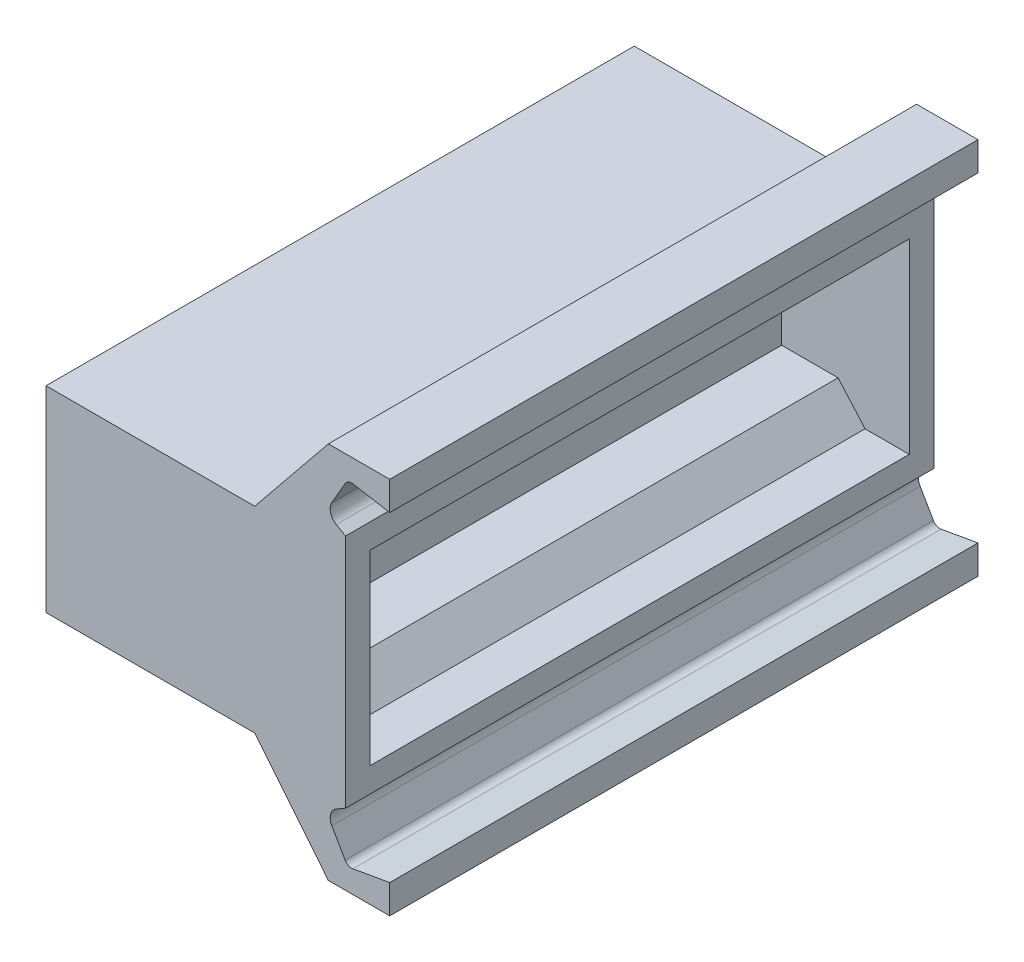
from build123d import *

# Parameters (mm, degrees)
BOSS_EXTRU_1_DEPTH      = 11.98
BOSS_EXTRU_1_DEPTH_BACK = 11.98
BOSS_EXTRU_2_DEPTH      = 1
ESQUISSE3_R             = 1.4
ENL_V_MAT_EXTRU_1_DEPTH = 16.868545408


with BuildPart() as part:
    # Esquisse1 → Boss.-Extru.1 (new, two sides: drawn at the far end of the back side and taken through both)
    with BuildSketch(Plane.XY.offset(-BOSS_EXTRU_1_DEPTH_BACK)):
        with BuildLine():
            Line((0, 4), (0, 2.5))
            Line((0, 2.5), (4.8, 2.5))
            Line((4.8, 2.5), (4.8, -2.5))
            Line((4.8, -2.5), (0, -2.5))
            Line((0, -2.5), (0, -4))
            Line((0, -4), (8.500076, -4))
            Line((8.500076, -4), (11.500006965, -7.699978353))
            Line((11.500006965, -7.699978353), (14, -7.699978353))
            Line((14, -7.699978353), (14, -6.524983133))
            Line((14, -6.524983133), (12.498521064, -6.789609096))
            ThreePointArc((12.498521064, -6.789609096), (12.319554673, -6.766083995), (12.186482634, -6.644124034))
            Line((12.186482634, -6.644124034), (11.641375242, -5.699594361))
            ThreePointArc((11.641375242, -5.699594361), (11.590815941, -5.322605229), (11.820116831, -5.019128457))
            Line((11.820116831, -5.019128457), (12.19995, -4.799870197))
            Line((12.19995, -4.799870197), (12.19995, -3.799987301))
            Line((12.19995, -3.799987301), (10.399918669, -3.799987301))
            Line((10.399918669, -3.799987301), (9.3, -2.549913972))
            Line((9.3, -2.549913972), (7, -2.549913972))
            Line((7, -2.549913972), (7, 2.550086028))
            Line((7, 2.550086028), (9.3, 2.550086028))
            Line((9.3, 2.550086028), (10.399918669, 3.800106202))
            Line((10.399918669, 3.800106202), (12.19995, 3.800106202))
            Line((12.19995, 3.800106202), (12.19995, 4.800033133))
            Line((12.19995, 4.800033133), (11.824382637, 5.01686254))
            ThreePointArc((11.824382637, 5.01686254), (11.591449393, 5.320453932), (11.641389736, 5.699837105))
            Line((11.641389736, 5.699837105), (12.186568343, 6.644209348))
            ThreePointArc((12.186568343, 6.644209348), (12.319573629, 6.766106706), (12.4984419, 6.789676051))
            Line((12.4984419, 6.789676051), (14, 6.524983133))
            Line((14, 6.524983133), (14, 7.700021647))
            Line((14, 7.700021647), (11.499988165, 7.700021647))
            Line((11.499988165, 7.700021647), (8.500082, 4))
            Line((8.500082, 4), (0, 4))
        make_face()
    extrude(amount=BOSS_EXTRU_1_DEPTH + BOSS_EXTRU_1_DEPTH_BACK)

    # Esquisse4 → Boss.-Extru.2 (add)
    with BuildSketch(Plane.XY.offset(11.98)):
        Polygon((10.399918669, 3.800106202), (12.19995, 3.800106202), (12.19995, -3.799987301), (10.399918669, -3.799987301), (9.3, -2.549913972), (7, -2.549913972), (0, -2.5), (0, 2.5), (7, 2.550086028), (9.3, 2.550086028), align=None)
    boss_extru_2 = extrude(amount=-BOSS_EXTRU_2_DEPTH)

    # Symétrie1: Boss.-Extru.2 across plane
    add(boss_extru_2.mirror(Plane.XY))

    # Esquisse3 → Enlèv. mat.-Extru.1 (cut, through all)
    with BuildSketch(Plane(origin=(7, 0, 0), x_dir=(0, 0, -1), z_dir=(1, 0, 0))):
        Circle(ESQUISSE3_R)
        with Locations((-5.08, 0)):
            Circle(ESQUISSE3_R)
        with Locations((5.08, 0)):
            Circle(ESQUISSE3_R)
    extrude(amount=-ENL_V_MAT_EXTRU_1_DEPTH, mode=Mode.SUBTRACT)


solid = part.part
